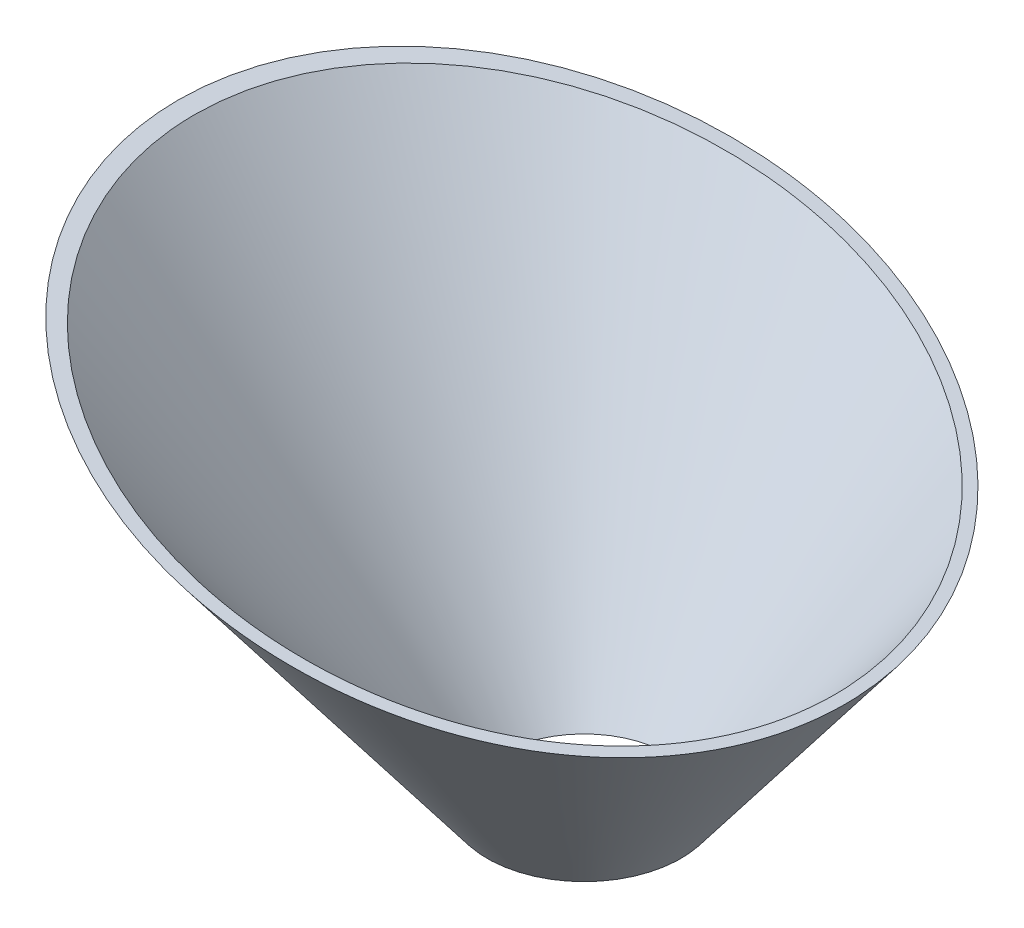
from build123d import *

# Parameters (mm, degrees)
SHELL1_T                = -2.54
CUT_EXTRUDE4_DEPTH      = 176.976362049
CUT_EXTRUDE4_DEPTH_BACK = 176.976362049


with BuildPart() as part:
    # Sketch3 → Revolve1 (revolve)
    with BuildSketch(Plane.XY, mode=Mode.PRIVATE) as revolve1_sk:
        Polygon((0, 0), (-24.257, 0), (-101.6, 101.6), (0, 101.6), align=None)
    revolve(revolve1_sk.sketch.rotate(Axis((0, 0, 0), (0, 1, 0)), 90), axis=Axis((0, 0, 0), (0, 1, 0)))

    # Shell1
    shell1_openings = [part.faces().sort_by_distance(p)[0] for p in [
        (0, 101.6, 0),
        (0, 0, 0),
    ]]
    offset(amount=SHELL1_T, openings=shell1_openings, kind=Kind.INTERSECTION)

    # Sketch4 → Cut-Extrude4 (cut, two sides: drawn at the far end of the back side and taken through both)
    with BuildSketch(Plane.XY.offset(-CUT_EXTRUDE4_DEPTH_BACK)):
        Polygon((101.6, 101.6), (0, 101.6), (-101.6, 101.6), (65.441557357, 54.101224771), align=None)
    extrude(amount=CUT_EXTRUDE4_DEPTH + CUT_EXTRUDE4_DEPTH_BACK, mode=Mode.SUBTRACT)


solid = part.part
